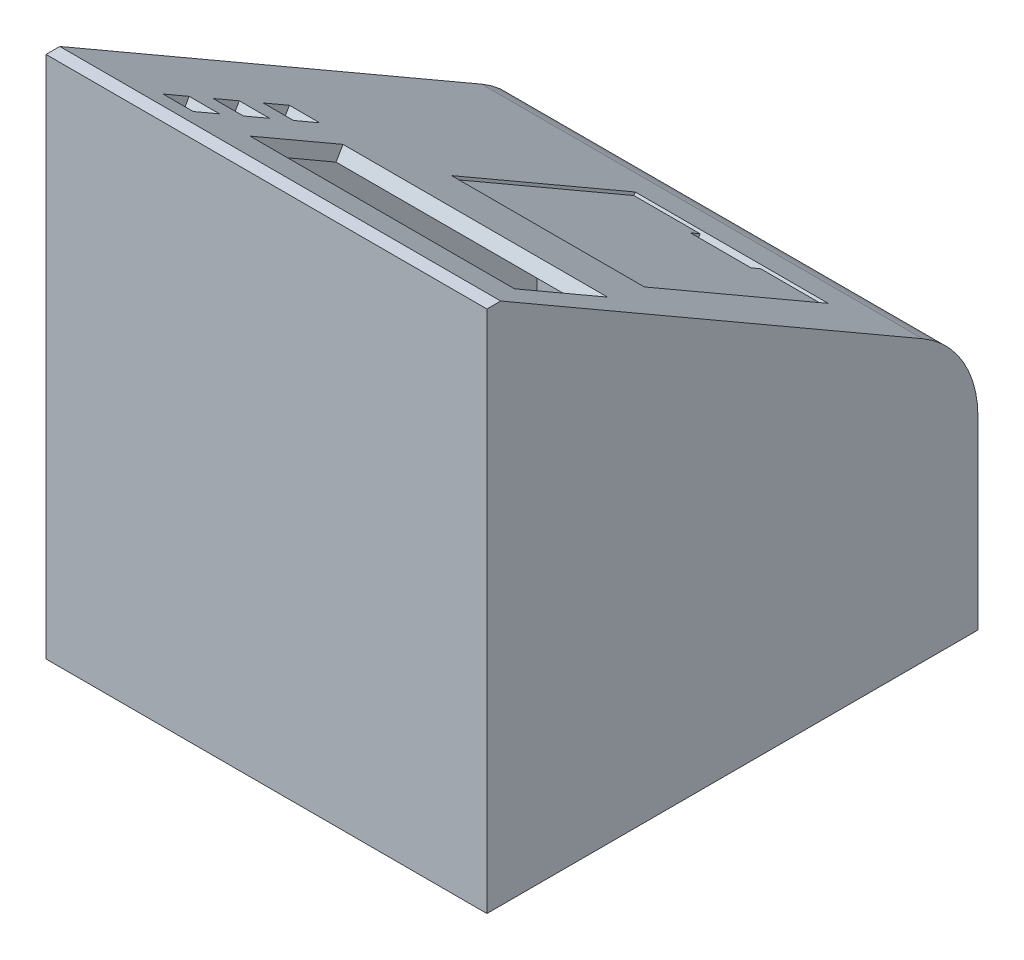
from build123d import *

# Parameters (mm, degrees)
BOSS_EXTRUDE1_DEPTH  = 5
SKETCH2_W            = 160
SKETCH2_H            = 200
BOSS_EXTRUDE2_DEPTH  = 5
SKETCH4_W            = 160
SKETCH4_H            = 190
BOSS_EXTRUDE4_DEPTH  = 5
SKETCH5_W            = 160
SKETCH5_H            = 90
BOSS_EXTRUDE5_DEPTH  = 5
SKETCH6_W            = 96
SKETCH6_H            = 39
SKETCH6_W_2          = 11
SKETCH6_H_2          = 11
CUT_EXTRUDE2_DEPTH   = 5
FILLET1_R            = 40
SKETCH7_W            = 70
SKETCH7_H            = 77
CUT_EXTRUDE3_DEPTH   = 1
SKETCH8_W            = 22
SKETCH8_H            = 4
CUT_EXTRUDE4_DEPTH   = 4
SKETCH9_W            = 40
SKETCH9_H            = 60
CUT_EXTRUDE5_DEPTH   = 5
SKETCH12_W           = 40
SKETCH12_H           = 60
BOSS_EXTRUDE6_DEPTH  = 2
SKETCH14_W           = 77
SKETCH14_H           = 53
CUT_EXTRUDE6_DEPTH   = 5
SKETCH15_W           = 3
SKETCH15_H           = 29
CUT_EXTRUDE7_DEPTH   = 5
SKETCH17_R           = 1.75
CUT_EXTRUDE9_DEPTH   = 4
SKETCH21_R           = 1.5
BOSS_EXTRUDE8_DEPTH  = 4
SKETCH23_R           = 1.5
BOSS_EXTRUDE9_DEPTH  = 10
SKETCH25_R           = 1.5
BOSS_EXTRUDE10_DEPTH = 10


with BuildPart() as part:
    # Sketch1 → Boss-Extrude1 (new body)
    with BuildSketch(Plane(origin=(0, 0, 0), x_dir=(0, 0, -1), z_dir=(1, 0, 0))):
        Polygon((0, 0), (173.205080757, -100), (173.205080757, -190), (0, -190), align=None)
    boss_extrude1 = extrude(amount=BOSS_EXTRUDE1_DEPTH)

    # Sketch2 → Boss-Extrude2 (add)
    with BuildSketch(Plane(origin=(0, 0, 0), x_dir=(1, 0, 0), z_dir=(0, 0.8660254037844382, -0.5000000000000011))):
        with Locations((80, 100)):
            Rectangle(SKETCH2_W, SKETCH2_H)
    extrude(amount=-BOSS_EXTRUDE2_DEPTH)

    # Sketch4 → Boss-Extrude4 (add)
    with BuildSketch(Plane.XY):
        with Locations((80, -95)):
            Rectangle(SKETCH4_W, SKETCH4_H)
    extrude(amount=BOSS_EXTRUDE4_DEPTH)

    # Sketch5 → Boss-Extrude5 (add)
    with BuildSketch(Plane(origin=(0, 0, -173.205080757), x_dir=(-1, 0, 0), z_dir=(0, 0, -1))):
        with Locations((-80, -145)):
            Rectangle(SKETCH5_W, SKETCH5_H)
    extrude(amount=-BOSS_EXTRUDE5_DEPTH)

    # Mirror1: Boss-Extrude1 across plane
    add(boss_extrude1.mirror(Plane.ZY.offset(-80)))

    # Sketch6 → Cut-Extrude2 (cut)
    with BuildSketch(Plane(origin=(0, 0, 0), x_dir=(1, 0, 0), z_dir=(0, 0.8660254037844382, -0.5000000000000011))):
        with Locations((102, 36.815172727)):
            Rectangle(SKETCH6_W, SKETCH6_H)
        with Locations((34, 15.815172727)):
            Rectangle(SKETCH6_W_2, SKETCH6_H_2)
        with Locations((34, 36.815172727)):
            Rectangle(SKETCH6_W_2, SKETCH6_H_2)
        with Locations((34, 57.815172727)):
            Rectangle(SKETCH6_W_2, SKETCH6_H_2)
    extrude(amount=-CUT_EXTRUDE2_DEPTH, mode=Mode.SUBTRACT)

    # Fillet1
    fillet1_edges = [part.edges().sort_by_distance(p)[0] for p in [
        (80, -100, -173.205080757),
    ]]
    fillet(fillet1_edges, radius=FILLET1_R)

    # Sketch7 → Cut-Extrude3 (cut)
    with BuildSketch(Plane(origin=(0, 0, 0), x_dir=(1, 0, 0), z_dir=(0, 0.8660254037844382, -0.5000000000000011))):
        with Locations((105, 121.815172727)):
            Rectangle(SKETCH7_W, SKETCH7_H)
    extrude(amount=-CUT_EXTRUDE3_DEPTH, mode=Mode.SUBTRACT)

    # Sketch8 → Cut-Extrude4 (cut)
    with BuildSketch(Plane(origin=(0, -0.866025403784426, 0.4999999999999943), x_dir=(1, 0, 0), z_dir=(0, 0.8660254037844382, -0.5000000000000011))):
        with Locations((105, 158.315172727)):
            Rectangle(SKETCH8_W, SKETCH8_H)
    extrude(amount=-CUT_EXTRUDE4_DEPTH, mode=Mode.SUBTRACT)

    # Sketch9 → Cut-Extrude5 (cut)
    with BuildSketch(Plane(origin=(0, 0, 0), x_dir=(1, 0, 0), z_dir=(0, 0.8660254037844382, -0.5000000000000011))):
        with Locations((35, 121.815172727)):
            Rectangle(SKETCH9_W, SKETCH9_H)
    extrude(amount=-CUT_EXTRUDE5_DEPTH, mode=Mode.SUBTRACT)

    # Sketch12 → Boss-Extrude6 (add)
    with BuildSketch(Plane(origin=(0, 0, 0), x_dir=(1, 0, 0), z_dir=(0, 0.8660254037844382, -0.5000000000000011))):
        with Locations((35, 121.815172727)):
            Rectangle(SKETCH12_W, SKETCH12_H)
    extrude(amount=-BOSS_EXTRUDE6_DEPTH)

    # Sketch14 → Cut-Extrude6 (cut)
    with BuildSketch(Plane(origin=(0, 0, -173.205080757), x_dir=(-1, 0, 0), z_dir=(0, 0, -1))):
        with Locations((-101.5, -156.594010768)):
            Rectangle(SKETCH14_W, SKETCH14_H)
    extrude(amount=-CUT_EXTRUDE6_DEPTH, mode=Mode.SUBTRACT)

    # Sketch15 → Cut-Extrude7 (cut)
    with BuildSketch(Plane(origin=(0, 0, -173.205080757), x_dir=(-1, 0, 0), z_dir=(0, 0, -1))):
        with Locations((-61.5, -156.594010768)):
            Rectangle(SKETCH15_W, SKETCH15_H)
        with Locations((-141.5, -156.594010768)):
            Rectangle(SKETCH15_W, SKETCH15_H)
    extrude(amount=-CUT_EXTRUDE7_DEPTH, mode=Mode.SUBTRACT)

    # Sketch17 → Cut-Extrude9 (cut)
    with BuildSketch(Plane(origin=(0, -4.330127019, 2.5), x_dir=(-1, 0, 0), z_dir=(0, -0.8660254037844382, 0.500000000000001))):
        with Locations(Location((-54.75, 64.989476433, 0), (0, 0, 90))):
            Circle(SKETCH17_R)
        with Locations(Location((-149.25, 64.989476433, 0), (0, 0, 270))):
            Circle(SKETCH17_R)
        with Locations(Location((-54.75, 8.489476433, 0), (0, 0, 270))):
            Circle(SKETCH17_R)
        with Locations(Location((-149.25, 8.489476433, 0), (0, 0, 90))):
            Circle(SKETCH17_R)
    extrude(amount=-CUT_EXTRUDE9_DEPTH, mode=Mode.SUBTRACT)

    # Sketch21 → Boss-Extrude8 (add)
    with BuildSketch(Plane(origin=(0, -1.732050808, 1), x_dir=(-1, 0, 0), z_dir=(0, -0.8660254037844382, 0.500000000000001))):
        with Locations(Location((-48.5, 98.315172727, 0), (0, 0, 270))):
            Circle(SKETCH21_R)
        with Locations(Location((-21.5, 97.315172727, 0), (0, 0, 270))):
            Circle(SKETCH21_R)
        with Locations(Location((-17.5, 136.315172727, 0), (0, 0, 270))):
            Circle(SKETCH21_R)
        with Locations(Location((-52.5, 136.315172727, 0), (0, 0, 270))):
            Circle(SKETCH21_R)
    extrude(amount=BOSS_EXTRUDE8_DEPTH)

    # Sketch23 → Boss-Extrude9 (add)
    with BuildSketch(Plane(origin=(0, -190, 0), x_dir=(-1, 0, 0), z_dir=(0, -1, 0))):
        with BuildLine():
            Line((-155, 0), (-145, 0))
            ThreePointArc((-145, 0), (-147.928932188, 7.071067812), (-155, 10))
            Line((-155, 10), (-155, 0))
        make_face()
        with Locations(Location((-151.751738587, 3.801157428, 0), (0, 0, 90))):
            Circle(SKETCH23_R, mode=Mode.SUBTRACT)
    boss_extrude9 = extrude(amount=-BOSS_EXTRUDE9_DEPTH)

    # Mirror2: Boss-Extrude9 across plane
    add(boss_extrude9.mirror(Plane.ZY.offset(-80)))

    # Sketch25 → Boss-Extrude10 (add)
    with BuildSketch(Plane(origin=(0, -190, 0), x_dir=(-1, 0, 0), z_dir=(0, -1, 0))):
        with BuildLine():
            Line((-155, 168.205080757), (-145, 168.205080757))
            ThreePointArc((-145, 168.205080757), (-147.928932188, 161.134012945), (-155, 158.205080757))
            Line((-155, 158.205080757), (-155, 168.205080757))
        make_face()
        with Locations(Location((-151.620258089, 164.520335906, 0), (0, 0, 90))):
            Circle(SKETCH25_R, mode=Mode.SUBTRACT)
    boss_extrude10 = extrude(amount=-BOSS_EXTRUDE10_DEPTH)

    # Mirror4: Boss-Extrude10 across plane
    add(boss_extrude10.mirror(Plane.ZY.offset(-80)))


solid = part.part
